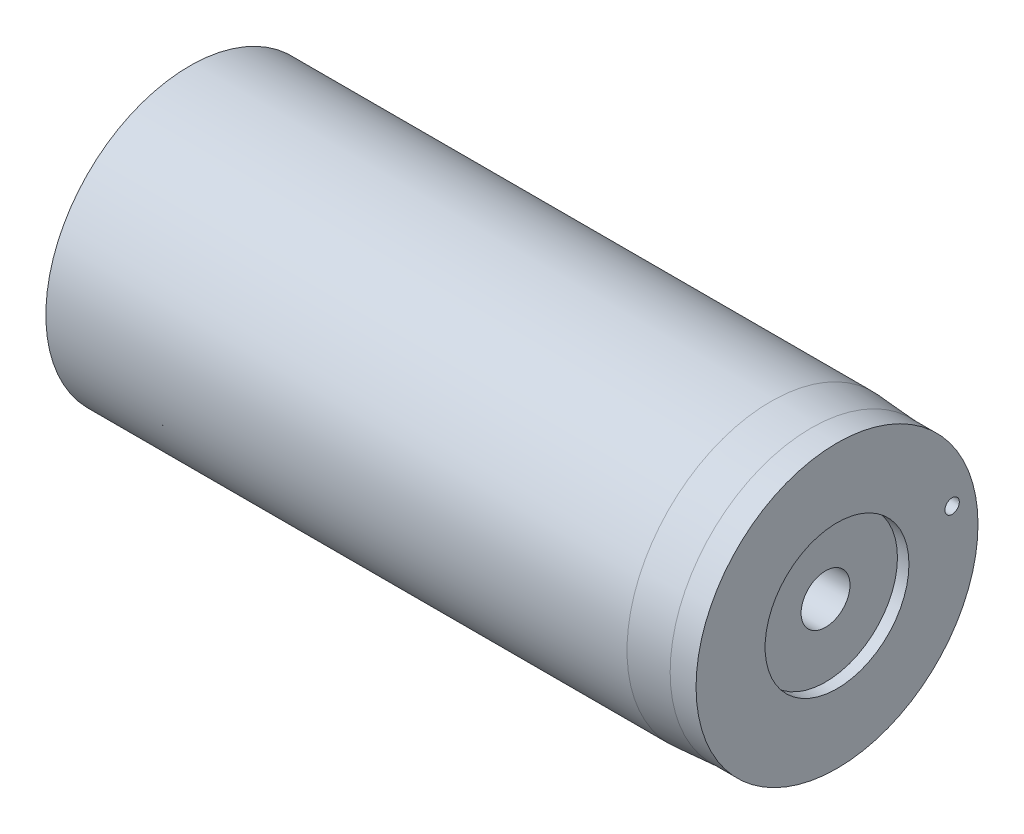
from build123d import *

# Parameters (mm, degrees)
TROU_TARAUD_M61_D = 5


with BuildPart() as part:
    # Esquisse1 → Révolution1 (revolve)
    with BuildSketch(Plane.XY, mode=Mode.PRIVATE) as r_volution1_sk:
        with BuildLine():
            Line((-0.761813432, 25), (-0.761813432, 49))
            Line((-0.761813432, 49), (-9.761813432, 49))
            Line((-9.761813432, 49), (-23.761813432, 50))
            Line((-23.761813432, 50), (-225.761813432, 50))
            Line((-225.761813432, 50), (-225.761813432, 48.5))
            Line((-225.761813432, 48.5), (-221.761813432, 48.5))
            Line((-221.761813432, 48.5), (-221.761813432, 48))
            Line((-221.761813432, 48), (-214.261813432, 48))
            Line((-214.261813432, 48), (-214.261813432, 45.503048629))
            ThreePointArc((-214.261813432, 45.503048629), (-214.05779592, 45.001981665), (-213.856039491, 44.5))
            Line((-213.856039491, 44.5), (-9.761813432, 44.5))
            Line((-9.761813432, 44.5), (-9.761813432, 15))
            Line((-9.761813432, 15), (-24.761813432, 15))
            Line((-24.761813432, 15), (-24.761813432, 12.5))
            Line((-24.761813432, 12.5), (-64.761813432, 12.5))
            Line((-64.761813432, 12.5), (-64.761813432, 10))
            Line((-64.761813432, 10), (-124.761813432, 10))
            Line((-124.761813432, 10), (-124.761813432, 8.5))
            Line((-124.761813432, 8.5), (-4.761813432, 8.5))
            Line((-4.761813432, 8.5), (-4.761813432, 25))
            Line((-4.761813432, 25), (-0.761813432, 25))
        make_face()
    revolve(r_volution1_sk.sketch.rotate(Axis((0, 0, 0), (-1, 0, 0)), 90), axis=Axis((0, 0, 0), (-1, 0, 0)))

    # Trou taraudé M61 (through all)
    with Locations(Plane(origin=(-0.761813432, 0, 0), x_dir=(0, 0, -1), z_dir=(1, 0, 0))):
        with Locations((40, 10)):
            Hole(TROU_TARAUD_M61_D / 2)


solid = part.part
